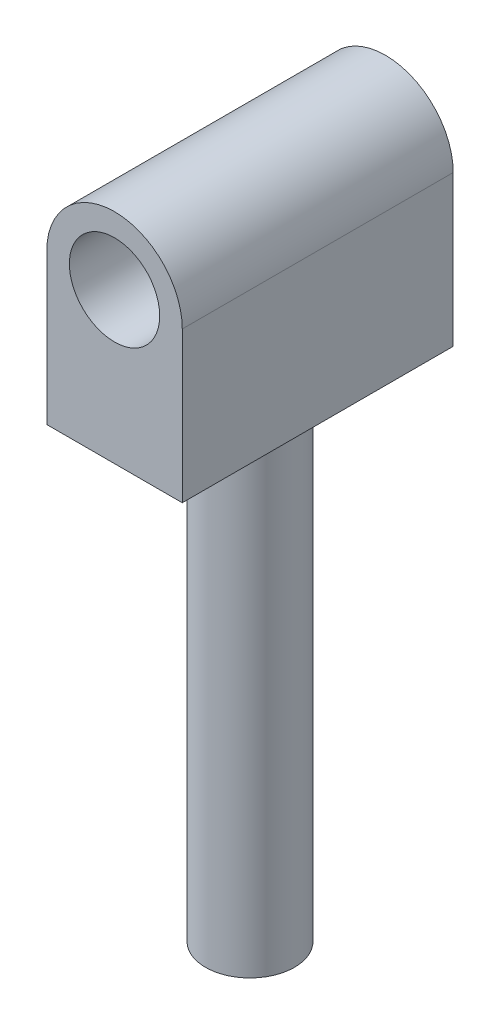
from build123d import *

# Parameters (mm, degrees)
BOSS_EXTRUDE1_DEPTH = 45.72
SKETCH2_R           = 7.62
CUT_EXTRUDE1_DEPTH  = 10.414
SKETCH3_R           = 7.62
CUT_EXTRUDE2_DEPTH  = 76.2
BOSS_EXTRUDE2_DEPTH = 81.28


with BuildPart() as part:
    # Sketch1 → Boss-Extrude1 (new body)
    with BuildSketch(Plane.XY):
        with BuildLine():
            Line((-11.43, 0), (-11.43, -25.4))
            Line((-11.43, -25.4), (11.43, -25.4))
            Line((11.43, -25.4), (11.43, 0))
            ThreePointArc((11.43, 0), (0, 11.43), (-11.43, 0))
        make_face()
    extrude(amount=BOSS_EXTRUDE1_DEPTH)

    # Sketch2 → Cut-Extrude1 (cut)
    with BuildSketch(Plane.XY.offset(45.72)):
        Circle(SKETCH2_R)
    extrude(amount=-CUT_EXTRUDE1_DEPTH, mode=Mode.SUBTRACT)

    # Sketch3 → Cut-Extrude2 (cut)
    with BuildSketch(Plane.XY.offset(45.72)):
        Circle(SKETCH3_R)
    extrude(amount=-CUT_EXTRUDE2_DEPTH, mode=Mode.SUBTRACT)

    # Sketch4 → Boss-Extrude2 (add)
    with BuildSketch(Plane.XZ.offset(25.4)):
        with BuildLine():
            ThreePointArc((-7.514066823, 22.86), (-5.313247605, 17.546752395), (0, 15.345933177))
            Line((0, 15.345933177), (0, 22.86))
            Line((0, 22.86), (-7.514066823, 22.86))
        make_face()
        with BuildLine():
            Line((0, 22.86), (0, 15.345933177))
            ThreePointArc((0, 15.345933177), (5.313247605, 17.546752395), (7.514066823, 22.86))
            Line((7.514066823, 22.86), (0, 22.86))
        make_face()
        with BuildLine():
            Line((-7.514066823, 22.86), (0, 22.86))
            Line((0, 22.86), (0, 30.374066823))
            ThreePointArc((0, 30.374066823), (-5.313247605, 28.173247605), (-7.514066823, 22.86))
        make_face()
        with BuildLine():
            Line((0, 30.374066823), (0, 22.86))
            Line((0, 22.86), (7.514066823, 22.86))
            ThreePointArc((7.514066823, 22.86), (5.313247605, 28.173247605), (0, 30.374066823))
        make_face()
    extrude(amount=BOSS_EXTRUDE2_DEPTH)


solid = part.part
